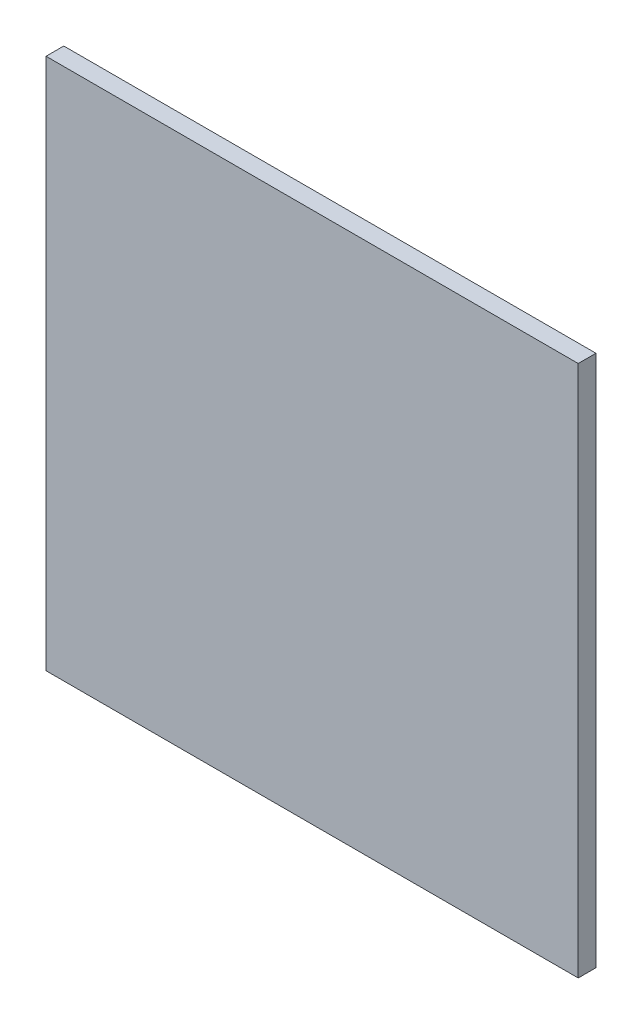
from build123d import *

# Parameters (mm, degrees)
ESQUISSE1_W        = 60
ESQUISSE1_H        = 60
BOSS_EXTRU_1_DEPTH = 2


with BuildPart() as part:
    # Esquisse1 → Boss.-Extru.1 (new body)
    with BuildSketch(Plane.XY):
        with Locations((-3.083745295, -9.299603803)):
            Rectangle(ESQUISSE1_W, ESQUISSE1_H)
    extrude(amount=BOSS_EXTRU_1_DEPTH)


solid = part.part
